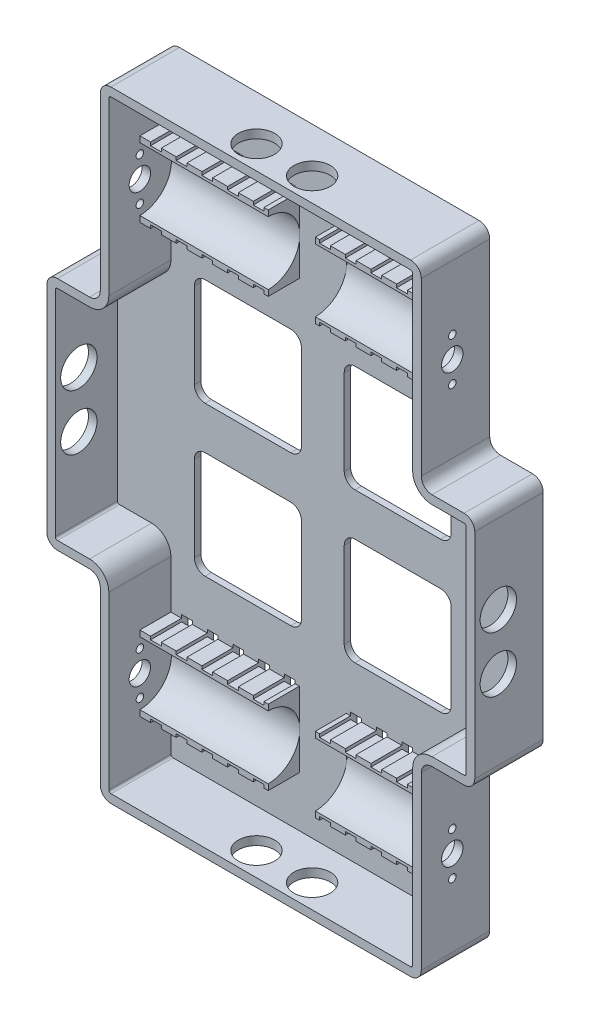
from build123d import *

# Parameters (mm, degrees)
BOSS_EXTRUDE1_DEPTH                          = 3
FILLET1_R                                    = 5
BOSS_EXTRUDE2_START                          = 29
BOSS_EXTRUDE2_DEPTH                          = 29
SKETCH3_R                                    = 5
SKETCH3_R_2                                  = 1.75
CUT_EXTRUDE1_DEPTH                           = 29
SKETCH4_W                                    = 60
SKETCH4_H                                    = 35
BOSS_EXTRUDE3_DEPTH                          = 14.5
SKETCH5_R                                    = 14.75
CUT_EXTRUDE2_DEPTH                           = 60
SKETCH7_W                                    = 5
SKETCH7_H                                    = 3
CUT_EXTRUDE3_DEPTH                           = 178.006355818
CUT_EXTRUDE4_DEPTH                           = 5
LPATTERN1_COUNT                              = 5
LPATTERN1_PITCH                              = 12
MIRROR1_COPY_1_SKETCH_W                      = 5
MIRROR1_COPY_1_SKETCH_H                      = 3
MIRROR1_COPY_1_DEPTH                         = 178.006355818
MIRROR1_COPY_2_SKETCH_W                      = 5
MIRROR1_COPY_2_SKETCH_H                      = 3
MIRROR1_COPY_2_DEPTH                         = 178.006355818
MIRROR1_COPY_3_SKETCH_W                      = 5
MIRROR1_COPY_3_SKETCH_H                      = 3
MIRROR1_COPY_3_DEPTH                         = 178.006355818
MIRROR1_COPY_4_SKETCH_W                      = 5
MIRROR1_COPY_4_SKETCH_H                      = 3
MIRROR1_COPY_4_DEPTH                         = 178.006355818
MIRROR1_COPY_5_DEPTH                         = 5
MIRROR1_COPY_6_DEPTH                         = 5
MIRROR1_COPY_7_DEPTH                         = 5
MIRROR1_COPY_8_DEPTH                         = 5
MIRROR1_AT_THE_SECOND_PLANE_COPY_1_SKETC_W   = 5
MIRROR1_AT_THE_SECOND_PLANE_COPY_1_SKETC_H   = 3
MIRROR1_AT_THE_SECOND_PLANE_COPY_1_DEPTH     = 178.006355818
MIRROR1_AT_THE_SECOND_PLANE_COPY_2_SKETC_W   = 5
MIRROR1_AT_THE_SECOND_PLANE_COPY_2_SKETC_H   = 3
MIRROR1_AT_THE_SECOND_PLANE_COPY_2_DEPTH     = 178.006355818
MIRROR1_AT_THE_SECOND_PLANE_COPY_3_SKETC_W   = 5
MIRROR1_AT_THE_SECOND_PLANE_COPY_3_SKETC_H   = 3
MIRROR1_AT_THE_SECOND_PLANE_COPY_3_DEPTH     = 178.006355818
MIRROR1_AT_THE_SECOND_PLANE_COPY_4_SKETC_W   = 5
MIRROR1_AT_THE_SECOND_PLANE_COPY_4_SKETC_H   = 3
MIRROR1_AT_THE_SECOND_PLANE_COPY_4_DEPTH     = 178.006355818
MIRROR1_AT_THE_SECOND_PLANE_COPY_5_DEPTH     = 5
MIRROR1_AT_THE_SECOND_PLANE_COPY_6_DEPTH     = 5
MIRROR1_AT_THE_SECOND_PLANE_COPY_7_DEPTH     = 5
MIRROR1_AT_THE_SECOND_PLANE_COPY_8_DEPTH     = 5
MIRROR1_AT_THE_SECOND_PLANE_COPY_9_SKETC_R   = 5
MIRROR1_AT_THE_SECOND_PLANE_COPY_9_SKETC_R_2 = 1.75
MIRROR1_AT_THE_SECOND_PLANE_COPY_9_DEPTH     = 29
MIRROR1_AT_THE_SECOND_PLANE_COPY_10_SKET_W   = 60
MIRROR1_AT_THE_SECOND_PLANE_COPY_10_SKET_H   = 35
MIRROR1_AT_THE_SECOND_PLANE_COPY_10_DEPTH    = 14.5
MIRROR1_AT_THE_SECOND_PLANE_COPY_11_SKET_R   = 14.75
MIRROR1_AT_THE_SECOND_PLANE_COPY_11_DEPTH    = 60
MIRROR1_AT_THE_SECOND_PLANE_COPY_12_SKET_W   = 5
MIRROR1_AT_THE_SECOND_PLANE_COPY_12_SKET_H   = 3
MIRROR1_AT_THE_SECOND_PLANE_COPY_12_DEPTH    = 178.006355818
MIRROR1_AT_THE_SECOND_PLANE_COPY_13_DEPTH    = 5
MIRROR1_AT_THE_SECOND_PLANE_COPY_14_SKET_W   = 5
MIRROR1_AT_THE_SECOND_PLANE_COPY_14_SKET_H   = 3
MIRROR1_AT_THE_SECOND_PLANE_COPY_14_DEPTH    = 178.006355818
MIRROR1_AT_THE_SECOND_PLANE_COPY_15_SKET_W   = 5
MIRROR1_AT_THE_SECOND_PLANE_COPY_15_SKET_H   = 3
MIRROR1_AT_THE_SECOND_PLANE_COPY_15_DEPTH    = 178.006355818
MIRROR1_AT_THE_SECOND_PLANE_COPY_16_SKET_W   = 5
MIRROR1_AT_THE_SECOND_PLANE_COPY_16_SKET_H   = 3
MIRROR1_AT_THE_SECOND_PLANE_COPY_16_DEPTH    = 178.006355818
MIRROR1_AT_THE_SECOND_PLANE_COPY_17_SKET_W   = 5
MIRROR1_AT_THE_SECOND_PLANE_COPY_17_SKET_H   = 3
MIRROR1_AT_THE_SECOND_PLANE_COPY_17_DEPTH    = 178.006355818
MIRROR1_AT_THE_SECOND_PLANE_COPY_18_DEPTH    = 5
MIRROR1_AT_THE_SECOND_PLANE_COPY_19_DEPTH    = 5
MIRROR1_AT_THE_SECOND_PLANE_COPY_20_DEPTH    = 5
MIRROR1_AT_THE_SECOND_PLANE_COPY_21_DEPTH    = 5
CUT_EXTRUDE6_REACH                           = 310.422
SKETCH11_R                                   = 8.5
SKETCH12_R                                   = 8.5
CUT_EXTRUDE7_DEPTH                           = 250.096366894
CUT_EXTRUDE8_DEPTH                           = 180.022344974
MIRROR3_AT_THE_SECOND_PLANE_COPY_1_DEPTH     = 180.022344974


with BuildPart() as part:
    # Sketch1 → Boss-Extrude1 (new body)
    with BuildSketch(Plane.XY):
        Polygon((-75, -145), (75, -145), (75, -55), (100, -55), (100, 55), (75, 55), (75, 145), (-75, 145), (-75, 55), (-100, 55), (-100, -55), (-75, -55), align=None)
    extrude(amount=BOSS_EXTRUDE1_DEPTH)

    # Fillet1
    fillet1_edges = [part.edges().sort_by_distance(p)[0] for p in [
        (-75, -55, 1.5),
        (-100, -55, 1.5),
        (-100, 55, 1.5),
        (-75, 55, 1.5),
        (-75, 145, 1.5),
        (75, 145, 1.5),
        (75, 55, 1.5),
        (100, 55, 1.5),
        (100, -55, 1.5),
        (75, -55, 1.5),
        (75, -145, 1.5),
        (-75, -145, 1.5),
    ]]
    fillet(fillet1_edges, radius=FILLET1_R)

    # Sketch2 → Boss-Extrude2 (add)
    with BuildSketch(Plane.XY.offset(3).offset(BOSS_EXTRUDE2_START)):
        with BuildLine():
            Line((-100, 50), (-100, -50))
            ThreePointArc((-100, -50), (-98.535533906, -53.535533906), (-95, -55))
            Line((-95, -55), (-80, -55))
            ThreePointArc((-80, -55), (-76.464466094, -56.464466094), (-75, -60))
            Line((-75, -60), (-75, -140))
            ThreePointArc((-75, -140), (-73.535533906, -143.535533906), (-70, -145))
            Line((-70, -145), (70, -145))
            ThreePointArc((70, -145), (73.535533906, -143.535533906), (75, -140))
            Line((75, -140), (75, -60))
            ThreePointArc((75, -60), (76.464466094, -56.464466094), (80, -55))
            Line((80, -55), (95, -55))
            ThreePointArc((95, -55), (98.535533906, -53.535533906), (100, -50))
            Line((100, -50), (100, 50))
            ThreePointArc((100, 50), (98.535533906, 53.535533906), (95, 55))
            Line((95, 55), (80, 55))
            ThreePointArc((80, 55), (76.464466094, 56.464466094), (75, 60))
            Line((75, 60), (75, 140))
            ThreePointArc((75, 140), (73.535533906, 143.535533906), (70, 145))
            Line((70, 145), (-70, 145))
            ThreePointArc((-70, 145), (-73.535533906, 143.535533906), (-75, 140))
            Line((-75, 140), (-75, 60))
            ThreePointArc((-75, 60), (-76.464466094, 56.464466094), (-80, 55))
            Line((-80, 55), (-95, 55))
            ThreePointArc((-95, 55), (-98.535533906, 53.535533906), (-100, 50))
        make_face()
        with BuildLine():
            Line((-96, 50), (-96, -50))
            ThreePointArc((-96, -50), (-95.707106781, -50.707106781), (-95, -51))
            Line((-95, -51), (-80, -51))
            ThreePointArc((-80, -51), (-73.636038969, -53.636038969), (-71, -60))
            Line((-71, -60), (-71, -140))
            ThreePointArc((-71, -140), (-70.707106781, -140.707106781), (-70, -141))
            Line((-70, -141), (70, -141))
            ThreePointArc((70, -141), (70.707106781, -140.707106781), (71, -140))
            Line((71, -140), (71, -60))
            ThreePointArc((71, -60), (73.636038969, -53.636038969), (80, -51))
            Line((80, -51), (95, -51))
            ThreePointArc((95, -51), (95.707106781, -50.707106781), (96, -50))
            Line((96, -50), (96, 50))
            ThreePointArc((96, 50), (95.707106781, 50.707106781), (95, 51))
            Line((95, 51), (80, 51))
            ThreePointArc((80, 51), (73.636038969, 53.636038969), (71, 60))
            Line((71, 60), (71, 140))
            ThreePointArc((71, 140), (70.707106781, 140.707106781), (70, 141))
            Line((70, 141), (-70, 141))
            ThreePointArc((-70, 141), (-70.707106781, 140.707106781), (-71, 140))
            Line((-71, 140), (-71, 60))
            ThreePointArc((-71, 60), (-73.636038969, 53.636038969), (-80, 51))
            Line((-80, 51), (-95, 51))
            ThreePointArc((-95, 51), (-95.707106781, 50.707106781), (-96, 50))
        make_face(mode=Mode.SUBTRACT)
    extrude(amount=-BOSS_EXTRUDE2_DEPTH)

    # Sketch3 → Cut-Extrude1 (cut)
    with BuildSketch(Plane.ZY.offset(75)):
        with Locations(Location((17.5, -100, 0), (0, 0, 270))):
            Circle(SKETCH3_R)
        with Locations(Location((17.5, -90, 0), (0, 0, 270))):
            Circle(SKETCH3_R_2)
        with Locations(Location((17.5, -110, 0), (0, 0, 270))):
            Circle(SKETCH3_R_2)
    cut_extrude1 = extrude(amount=-CUT_EXTRUDE1_DEPTH, mode=Mode.SUBTRACT)

    # Sketch4 → Boss-Extrude3 (add)
    with BuildSketch(Plane.XY.offset(3)):
        with Locations((-41, -100)):
            Rectangle(SKETCH4_W, SKETCH4_H)
    boss_extrude3 = extrude(amount=BOSS_EXTRUDE3_DEPTH)

    # Sketch5 → Cut-Extrude2 (cut)
    with BuildSketch(Plane(origin=(-11, 0, 0), x_dir=(0, 0, -1), z_dir=(1, 0, 0))):
        with Locations((-17.5, -100)):
            Circle(SKETCH5_R)
    cut_extrude2 = extrude(amount=-CUT_EXTRUDE2_DEPTH, mode=Mode.SUBTRACT)

    # Sketch7 → Cut-Extrude3 (cut, through all)
    with BuildSketch(Plane.XY.offset(17.5)):
        with Locations((-63.5, -117.5)):
            Rectangle(SKETCH7_W, SKETCH7_H)
        with Locations((-63.5, -82.5)):
            Rectangle(SKETCH7_W, SKETCH7_H)
    cut_extrude3 = extrude(amount=-CUT_EXTRUDE3_DEPTH, mode=Mode.SUBTRACT)

    # Sketch8 → Cut-Extrude4 (cut)
    with BuildSketch(Plane(origin=(-66, 0, 0), x_dir=(0, 0, -1), z_dir=(1, 0, 0))):
        Polygon((0, -84), (0, -116), (-3, -116), (-1.5, -114.5), (-1.5, -85.5), (-3, -84), align=None)
    cut_extrude4 = extrude(amount=CUT_EXTRUDE4_DEPTH, mode=Mode.SUBTRACT)

    # LPattern1: Cut-Extrude3, Cut-Extrude4 ×5
    with Locations(*[(i * LPATTERN1_PITCH, 0, 0) for i in range(1, LPATTERN1_COUNT)]):
        add(cut_extrude3, mode=Mode.SUBTRACT)
        add(cut_extrude4, mode=Mode.SUBTRACT)

    # Mirror1: Cut-Extrude1, Boss-Extrude3, Cut-Extrude2, Cut-Extrude3, Cut-Extrude4 across plane
    add(cut_extrude1.mirror(Plane(origin=(0, 0, 0), x_dir=(0, 0, 1), z_dir=(1, 0, 0))), mode=Mode.SUBTRACT)
    add(boss_extrude3.mirror(Plane(origin=(0, 0, 0), x_dir=(0, 0, 1), z_dir=(1, 0, 0))))
    add(cut_extrude2.mirror(Plane(origin=(0, 0, 0), x_dir=(0, 0, 1), z_dir=(1, 0, 0))), mode=Mode.SUBTRACT)
    add(cut_extrude3.mirror(Plane(origin=(0, 0, 0), x_dir=(0, 0, 1), z_dir=(1, 0, 0))), mode=Mode.SUBTRACT)
    add(cut_extrude4.mirror(Plane(origin=(0, 0, 0), x_dir=(0, 0, 1), z_dir=(1, 0, 0))), mode=Mode.SUBTRACT)

    # Mirror1 copy 1 sketch → Mirror1 copy 1 (cut, through all)
    with BuildSketch(Plane(origin=(-12, 0, 17.5), x_dir=(-1, 0, 0), z_dir=(0, 0, 1))):
        with Locations((-63.5, 117.5)):
            Rectangle(MIRROR1_COPY_1_SKETCH_W, MIRROR1_COPY_1_SKETCH_H)
        with Locations((-63.5, 82.5)):
            Rectangle(MIRROR1_COPY_1_SKETCH_W, MIRROR1_COPY_1_SKETCH_H)
    extrude(amount=-MIRROR1_COPY_1_DEPTH, mode=Mode.SUBTRACT)

    # Mirror1 copy 2 sketch → Mirror1 copy 2 (cut, through all)
    with BuildSketch(Plane(origin=(-24, 0, 17.5), x_dir=(-1, 0, 0), z_dir=(0, 0, 1))):
        with Locations((-63.5, 117.5)):
            Rectangle(MIRROR1_COPY_2_SKETCH_W, MIRROR1_COPY_2_SKETCH_H)
        with Locations((-63.5, 82.5)):
            Rectangle(MIRROR1_COPY_2_SKETCH_W, MIRROR1_COPY_2_SKETCH_H)
    extrude(amount=-MIRROR1_COPY_2_DEPTH, mode=Mode.SUBTRACT)

    # Mirror1 copy 3 sketch → Mirror1 copy 3 (cut, through all)
    with BuildSketch(Plane(origin=(-36, 0, 17.5), x_dir=(-1, 0, 0), z_dir=(0, 0, 1))):
        with Locations((-63.5, 117.5)):
            Rectangle(MIRROR1_COPY_3_SKETCH_W, MIRROR1_COPY_3_SKETCH_H)
        with Locations((-63.5, 82.5)):
            Rectangle(MIRROR1_COPY_3_SKETCH_W, MIRROR1_COPY_3_SKETCH_H)
    extrude(amount=-MIRROR1_COPY_3_DEPTH, mode=Mode.SUBTRACT)

    # Mirror1 copy 4 sketch → Mirror1 copy 4 (cut, through all)
    with BuildSketch(Plane(origin=(-48, 0, 17.5), x_dir=(-1, 0, 0), z_dir=(0, 0, 1))):
        with Locations((-63.5, 117.5)):
            Rectangle(MIRROR1_COPY_4_SKETCH_W, MIRROR1_COPY_4_SKETCH_H)
        with Locations((-63.5, 82.5)):
            Rectangle(MIRROR1_COPY_4_SKETCH_W, MIRROR1_COPY_4_SKETCH_H)
    extrude(amount=-MIRROR1_COPY_4_DEPTH, mode=Mode.SUBTRACT)

    # Mirror1 copy 5 sketch → Mirror1 copy 5 (cut)
    with BuildSketch(Plane(origin=(54, 0, 0), x_dir=(0, 0, -1), z_dir=(-1, 0, 0))):
        Polygon((0, 84), (0, 116), (-3, 116), (-1.5, 114.5), (-1.5, 85.5), (-3, 84), align=None)
    extrude(amount=MIRROR1_COPY_5_DEPTH, mode=Mode.SUBTRACT)

    # Mirror1 copy 6 sketch → Mirror1 copy 6 (cut)
    with BuildSketch(Plane(origin=(42, 0, 0), x_dir=(0, 0, -1), z_dir=(-1, 0, 0))):
        Polygon((0, 84), (0, 116), (-3, 116), (-1.5, 114.5), (-1.5, 85.5), (-3, 84), align=None)
    extrude(amount=MIRROR1_COPY_6_DEPTH, mode=Mode.SUBTRACT)

    # Mirror1 copy 7 sketch → Mirror1 copy 7 (cut)
    with BuildSketch(Plane(origin=(30, 0, 0), x_dir=(0, 0, -1), z_dir=(-1, 0, 0))):
        Polygon((0, 84), (0, 116), (-3, 116), (-1.5, 114.5), (-1.5, 85.5), (-3, 84), align=None)
    extrude(amount=MIRROR1_COPY_7_DEPTH, mode=Mode.SUBTRACT)

    # Mirror1 copy 8 sketch → Mirror1 copy 8 (cut)
    with BuildSketch(Plane(origin=(18, 0, 0), x_dir=(0, 0, -1), z_dir=(-1, 0, 0))):
        Polygon((0, 84), (0, 116), (-3, 116), (-1.5, 114.5), (-1.5, 85.5), (-3, 84), align=None)
    extrude(amount=MIRROR1_COPY_8_DEPTH, mode=Mode.SUBTRACT)

    # Mirror1 at the second plane: Cut-Extrude1, Boss-Extrude3, Cut-Extrude2, Cut-Extrude3, Cut-Extrude4 across plane
    add(cut_extrude1.mirror(Plane.ZX), mode=Mode.SUBTRACT)
    add(boss_extrude3.mirror(Plane.ZX))
    add(cut_extrude2.mirror(Plane.ZX), mode=Mode.SUBTRACT)
    add(cut_extrude3.mirror(Plane.ZX), mode=Mode.SUBTRACT)
    add(cut_extrude4.mirror(Plane.ZX), mode=Mode.SUBTRACT)

    # Mirror1 at the second plane copy 1 sketc → Mirror1 at the second plane copy 1 (cut, through all)
    with BuildSketch(Plane(origin=(12, 0, 17.5), x_dir=(1, 0, 0), z_dir=(0, 0, 1))):
        with Locations((-63.5, 117.5)):
            Rectangle(MIRROR1_AT_THE_SECOND_PLANE_COPY_1_SKETC_W, MIRROR1_AT_THE_SECOND_PLANE_COPY_1_SKETC_H)
        with Locations((-63.5, 82.5)):
            Rectangle(MIRROR1_AT_THE_SECOND_PLANE_COPY_1_SKETC_W, MIRROR1_AT_THE_SECOND_PLANE_COPY_1_SKETC_H)
    extrude(amount=-MIRROR1_AT_THE_SECOND_PLANE_COPY_1_DEPTH, mode=Mode.SUBTRACT)

    # Mirror1 at the second plane copy 2 sketc → Mirror1 at the second plane copy 2 (cut, through all)
    with BuildSketch(Plane(origin=(24, 0, 17.5), x_dir=(1, 0, 0), z_dir=(0, 0, 1))):
        with Locations((-63.5, 117.5)):
            Rectangle(MIRROR1_AT_THE_SECOND_PLANE_COPY_2_SKETC_W, MIRROR1_AT_THE_SECOND_PLANE_COPY_2_SKETC_H)
        with Locations((-63.5, 82.5)):
            Rectangle(MIRROR1_AT_THE_SECOND_PLANE_COPY_2_SKETC_W, MIRROR1_AT_THE_SECOND_PLANE_COPY_2_SKETC_H)
    extrude(amount=-MIRROR1_AT_THE_SECOND_PLANE_COPY_2_DEPTH, mode=Mode.SUBTRACT)

    # Mirror1 at the second plane copy 3 sketc → Mirror1 at the second plane copy 3 (cut, through all)
    with BuildSketch(Plane(origin=(36, 0, 17.5), x_dir=(1, 0, 0), z_dir=(0, 0, 1))):
        with Locations((-63.5, 117.5)):
            Rectangle(MIRROR1_AT_THE_SECOND_PLANE_COPY_3_SKETC_W, MIRROR1_AT_THE_SECOND_PLANE_COPY_3_SKETC_H)
        with Locations((-63.5, 82.5)):
            Rectangle(MIRROR1_AT_THE_SECOND_PLANE_COPY_3_SKETC_W, MIRROR1_AT_THE_SECOND_PLANE_COPY_3_SKETC_H)
    extrude(amount=-MIRROR1_AT_THE_SECOND_PLANE_COPY_3_DEPTH, mode=Mode.SUBTRACT)

    # Mirror1 at the second plane copy 4 sketc → Mirror1 at the second plane copy 4 (cut, through all)
    with BuildSketch(Plane(origin=(48, 0, 17.5), x_dir=(1, 0, 0), z_dir=(0, 0, 1))):
        with Locations((-63.5, 117.5)):
            Rectangle(MIRROR1_AT_THE_SECOND_PLANE_COPY_4_SKETC_W, MIRROR1_AT_THE_SECOND_PLANE_COPY_4_SKETC_H)
        with Locations((-63.5, 82.5)):
            Rectangle(MIRROR1_AT_THE_SECOND_PLANE_COPY_4_SKETC_W, MIRROR1_AT_THE_SECOND_PLANE_COPY_4_SKETC_H)
    extrude(amount=-MIRROR1_AT_THE_SECOND_PLANE_COPY_4_DEPTH, mode=Mode.SUBTRACT)

    # Mirror1 at the second plane copy 5 sketc → Mirror1 at the second plane copy 5 (cut)
    with BuildSketch(Plane(origin=(-54, 0, 0), x_dir=(0, 0, -1), z_dir=(1, 0, 0))):
        Polygon((0, 84), (0, 116), (-3, 116), (-1.5, 114.5), (-1.5, 85.5), (-3, 84), align=None)
    extrude(amount=MIRROR1_AT_THE_SECOND_PLANE_COPY_5_DEPTH, mode=Mode.SUBTRACT)

    # Mirror1 at the second plane copy 6 sketc → Mirror1 at the second plane copy 6 (cut)
    with BuildSketch(Plane(origin=(-42, 0, 0), x_dir=(0, 0, -1), z_dir=(1, 0, 0))):
        Polygon((0, 84), (0, 116), (-3, 116), (-1.5, 114.5), (-1.5, 85.5), (-3, 84), align=None)
    extrude(amount=MIRROR1_AT_THE_SECOND_PLANE_COPY_6_DEPTH, mode=Mode.SUBTRACT)

    # Mirror1 at the second plane copy 7 sketc → Mirror1 at the second plane copy 7 (cut)
    with BuildSketch(Plane(origin=(-30, 0, 0), x_dir=(0, 0, -1), z_dir=(1, 0, 0))):
        Polygon((0, 84), (0, 116), (-3, 116), (-1.5, 114.5), (-1.5, 85.5), (-3, 84), align=None)
    extrude(amount=MIRROR1_AT_THE_SECOND_PLANE_COPY_7_DEPTH, mode=Mode.SUBTRACT)

    # Mirror1 at the second plane copy 8 sketc → Mirror1 at the second plane copy 8 (cut)
    with BuildSketch(Plane(origin=(-18, 0, 0), x_dir=(0, 0, -1), z_dir=(1, 0, 0))):
        Polygon((0, 84), (0, 116), (-3, 116), (-1.5, 114.5), (-1.5, 85.5), (-3, 84), align=None)
    extrude(amount=MIRROR1_AT_THE_SECOND_PLANE_COPY_8_DEPTH, mode=Mode.SUBTRACT)

    # Mirror1 at the second plane copy 9 sketc → Mirror1 at the second plane copy 9 (cut)
    with BuildSketch(Plane(origin=(75, 0, 0), x_dir=(0, 0, 1), z_dir=(1, 0, 0))):
        with Locations(Location((17.5, -100, 0), (0, 0, 270))):
            Circle(MIRROR1_AT_THE_SECOND_PLANE_COPY_9_SKETC_R)
        with Locations(Location((17.5, -90, 0), (0, 0, 270))):
            Circle(MIRROR1_AT_THE_SECOND_PLANE_COPY_9_SKETC_R_2)
        with Locations(Location((17.5, -110, 0), (0, 0, 270))):
            Circle(MIRROR1_AT_THE_SECOND_PLANE_COPY_9_SKETC_R_2)
    extrude(amount=-MIRROR1_AT_THE_SECOND_PLANE_COPY_9_DEPTH, mode=Mode.SUBTRACT)

    # Mirror1 at the second plane copy 10 sket → Mirror1 at the second plane copy 10 (add)
    with BuildSketch(Plane(origin=(0, 0, 3), x_dir=(-1, 0, 0), z_dir=(0, 0, 1))):
        with Locations((-41, -100)):
            Rectangle(MIRROR1_AT_THE_SECOND_PLANE_COPY_10_SKET_W, MIRROR1_AT_THE_SECOND_PLANE_COPY_10_SKET_H)
    extrude(amount=MIRROR1_AT_THE_SECOND_PLANE_COPY_10_DEPTH)

    # Mirror1 at the second plane copy 11 sket → Mirror1 at the second plane copy 11 (cut)
    with BuildSketch(Plane(origin=(11, 0, 0), x_dir=(0, 0, -1), z_dir=(-1, 0, 0))):
        with Locations((-17.5, -100)):
            Circle(MIRROR1_AT_THE_SECOND_PLANE_COPY_11_SKET_R)
    extrude(amount=-MIRROR1_AT_THE_SECOND_PLANE_COPY_11_DEPTH, mode=Mode.SUBTRACT)

    # Mirror1 at the second plane copy 12 sket → Mirror1 at the second plane copy 12 (cut, through all)
    with BuildSketch(Plane(origin=(0, 0, 17.5), x_dir=(-1, 0, 0), z_dir=(0, 0, 1))):
        with Locations((-63.5, -117.5)):
            Rectangle(MIRROR1_AT_THE_SECOND_PLANE_COPY_12_SKET_W, MIRROR1_AT_THE_SECOND_PLANE_COPY_12_SKET_H)
        with Locations((-63.5, -82.5)):
            Rectangle(MIRROR1_AT_THE_SECOND_PLANE_COPY_12_SKET_W, MIRROR1_AT_THE_SECOND_PLANE_COPY_12_SKET_H)
    extrude(amount=-MIRROR1_AT_THE_SECOND_PLANE_COPY_12_DEPTH, mode=Mode.SUBTRACT)

    # Mirror1 at the second plane copy 13 sket → Mirror1 at the second plane copy 13 (cut)
    with BuildSketch(Plane(origin=(66, 0, 0), x_dir=(0, 0, -1), z_dir=(-1, 0, 0))):
        Polygon((0, -84), (0, -116), (-3, -116), (-1.5, -114.5), (-1.5, -85.5), (-3, -84), align=None)
    extrude(amount=MIRROR1_AT_THE_SECOND_PLANE_COPY_13_DEPTH, mode=Mode.SUBTRACT)

    # Mirror1 at the second plane copy 14 sket → Mirror1 at the second plane copy 14 (cut, through all)
    with BuildSketch(Plane(origin=(-12, 0, 17.5), x_dir=(-1, 0, 0), z_dir=(0, 0, 1))):
        with Locations((-63.5, -117.5)):
            Rectangle(MIRROR1_AT_THE_SECOND_PLANE_COPY_14_SKET_W, MIRROR1_AT_THE_SECOND_PLANE_COPY_14_SKET_H)
        with Locations((-63.5, -82.5)):
            Rectangle(MIRROR1_AT_THE_SECOND_PLANE_COPY_14_SKET_W, MIRROR1_AT_THE_SECOND_PLANE_COPY_14_SKET_H)
    extrude(amount=-MIRROR1_AT_THE_SECOND_PLANE_COPY_14_DEPTH, mode=Mode.SUBTRACT)

    # Mirror1 at the second plane copy 15 sket → Mirror1 at the second plane copy 15 (cut, through all)
    with BuildSketch(Plane(origin=(-24, 0, 17.5), x_dir=(-1, 0, 0), z_dir=(0, 0, 1))):
        with Locations((-63.5, -117.5)):
            Rectangle(MIRROR1_AT_THE_SECOND_PLANE_COPY_15_SKET_W, MIRROR1_AT_THE_SECOND_PLANE_COPY_15_SKET_H)
        with Locations((-63.5, -82.5)):
            Rectangle(MIRROR1_AT_THE_SECOND_PLANE_COPY_15_SKET_W, MIRROR1_AT_THE_SECOND_PLANE_COPY_15_SKET_H)
    extrude(amount=-MIRROR1_AT_THE_SECOND_PLANE_COPY_15_DEPTH, mode=Mode.SUBTRACT)

    # Mirror1 at the second plane copy 16 sket → Mirror1 at the second plane copy 16 (cut, through all)
    with BuildSketch(Plane(origin=(-36, 0, 17.5), x_dir=(-1, 0, 0), z_dir=(0, 0, 1))):
        with Locations((-63.5, -117.5)):
            Rectangle(MIRROR1_AT_THE_SECOND_PLANE_COPY_16_SKET_W, MIRROR1_AT_THE_SECOND_PLANE_COPY_16_SKET_H)
        with Locations((-63.5, -82.5)):
            Rectangle(MIRROR1_AT_THE_SECOND_PLANE_COPY_16_SKET_W, MIRROR1_AT_THE_SECOND_PLANE_COPY_16_SKET_H)
    extrude(amount=-MIRROR1_AT_THE_SECOND_PLANE_COPY_16_DEPTH, mode=Mode.SUBTRACT)

    # Mirror1 at the second plane copy 17 sket → Mirror1 at the second plane copy 17 (cut, through all)
    with BuildSketch(Plane(origin=(-48, 0, 17.5), x_dir=(-1, 0, 0), z_dir=(0, 0, 1))):
        with Locations((-63.5, -117.5)):
            Rectangle(MIRROR1_AT_THE_SECOND_PLANE_COPY_17_SKET_W, MIRROR1_AT_THE_SECOND_PLANE_COPY_17_SKET_H)
        with Locations((-63.5, -82.5)):
            Rectangle(MIRROR1_AT_THE_SECOND_PLANE_COPY_17_SKET_W, MIRROR1_AT_THE_SECOND_PLANE_COPY_17_SKET_H)
    extrude(amount=-MIRROR1_AT_THE_SECOND_PLANE_COPY_17_DEPTH, mode=Mode.SUBTRACT)

    # Mirror1 at the second plane copy 18 sket → Mirror1 at the second plane copy 18 (cut)
    with BuildSketch(Plane(origin=(54, 0, 0), x_dir=(0, 0, -1), z_dir=(-1, 0, 0))):
        Polygon((0, -84), (0, -116), (-3, -116), (-1.5, -114.5), (-1.5, -85.5), (-3, -84), align=None)
    extrude(amount=MIRROR1_AT_THE_SECOND_PLANE_COPY_18_DEPTH, mode=Mode.SUBTRACT)

    # Mirror1 at the second plane copy 19 sket → Mirror1 at the second plane copy 19 (cut)
    with BuildSketch(Plane(origin=(42, 0, 0), x_dir=(0, 0, -1), z_dir=(-1, 0, 0))):
        Polygon((0, -84), (0, -116), (-3, -116), (-1.5, -114.5), (-1.5, -85.5), (-3, -84), align=None)
    extrude(amount=MIRROR1_AT_THE_SECOND_PLANE_COPY_19_DEPTH, mode=Mode.SUBTRACT)

    # Mirror1 at the second plane copy 20 sket → Mirror1 at the second plane copy 20 (cut)
    with BuildSketch(Plane(origin=(30, 0, 0), x_dir=(0, 0, -1), z_dir=(-1, 0, 0))):
        Polygon((0, -84), (0, -116), (-3, -116), (-1.5, -114.5), (-1.5, -85.5), (-3, -84), align=None)
    extrude(amount=MIRROR1_AT_THE_SECOND_PLANE_COPY_20_DEPTH, mode=Mode.SUBTRACT)

    # Mirror1 at the second plane copy 21 sket → Mirror1 at the second plane copy 21 (cut)
    with BuildSketch(Plane(origin=(18, 0, 0), x_dir=(0, 0, -1), z_dir=(-1, 0, 0))):
        Polygon((0, -84), (0, -116), (-3, -116), (-1.5, -114.5), (-1.5, -85.5), (-3, -84), align=None)
    extrude(amount=MIRROR1_AT_THE_SECOND_PLANE_COPY_21_DEPTH, mode=Mode.SUBTRACT)

    # Sketch11 → Cut-Extrude6 (cut, up to next)
    with BuildSketch(Plane(origin=(0, 145, 0), x_dir=(1, 0, 0), z_dir=(0, 1, 0)), mode=Mode.PRIVATE) as cut_extrude6_sk1:
        with Locations(Location((-13, -21, 0), (0, 0, 180))):
            Circle(SKETCH11_R)
    cut_extrude6_tool1 = extrude(cut_extrude6_sk1.sketch, amount=-CUT_EXTRUDE6_REACH, mode=Mode.PRIVATE) & part.part
    # Sketch11 → Cut-Extrude6 (cut, up to next)
    with BuildSketch(Plane(origin=(0, 145, 0), x_dir=(1, 0, 0), z_dir=(0, 1, 0)), mode=Mode.PRIVATE) as cut_extrude6_sk2:
        with Locations(Location((13, -21, 0), (0, 0, 180))):
            Circle(SKETCH11_R)
    cut_extrude6_tool2 = extrude(cut_extrude6_sk2.sketch, amount=-CUT_EXTRUDE6_REACH, mode=Mode.PRIVATE) & part.part
    cut_extrude6_1 = cut_extrude6_tool1.solids().sort_by_distance((-13, 145, 21))[0]
    add(cut_extrude6_1, mode=Mode.SUBTRACT)
    cut_extrude6_2 = cut_extrude6_tool2.solids().sort_by_distance((13, 145, 21))[0]
    add(cut_extrude6_2, mode=Mode.SUBTRACT)
    cut_extrude6 = cut_extrude6_1 + cut_extrude6_2  # Cut-Extrude6 as one shape, for the pattern or mirror that repeats it

    # Mirror2: Cut-Extrude6 across plane
    add(cut_extrude6.mirror(Plane.ZX), mode=Mode.SUBTRACT)

    # Sketch12 → Cut-Extrude7 (cut, through all)
    with BuildSketch(Plane(origin=(100, 0, 0), x_dir=(0, 0, -1), z_dir=(1, 0, 0))):
        with Locations((-21, 13)):
            Circle(SKETCH12_R)
        with Locations((-21, -13)):
            Circle(SKETCH12_R)
    extrude(amount=-CUT_EXTRUDE7_DEPTH, mode=Mode.SUBTRACT)

    # Sketch13 → Cut-Extrude8 (cut, through all)
    with BuildSketch(Plane(origin=(0, 0, 0), x_dir=(-1, 0, 0), z_dir=(0, 0, -1))):
        with BuildLine():
            Line((-55, 60), (-15, 60))
            ThreePointArc((-15, 60), (-11.464466094, 58.535533906), (-10, 55))
            Line((-10, 55), (-10, 15))
            ThreePointArc((-10, 15), (-11.464466094, 11.464466094), (-15, 10))
            Line((-15, 10), (-55, 10))
            ThreePointArc((-55, 10), (-58.535533906, 11.464466094), (-60, 15))
            Line((-60, 15), (-60, 55))
            ThreePointArc((-60, 55), (-58.535533906, 58.535533906), (-55, 60))
        make_face()
    cut_extrude8 = extrude(amount=-CUT_EXTRUDE8_DEPTH, mode=Mode.SUBTRACT)

    # Mirror3: Cut-Extrude8 across plane
    add(cut_extrude8.mirror(Plane(origin=(0, 0, 0), x_dir=(0, 0, 1), z_dir=(1, 0, 0))), mode=Mode.SUBTRACT)

    # Mirror3 at the second plane: Cut-Extrude8 across plane
    add(cut_extrude8.mirror(Plane.ZX), mode=Mode.SUBTRACT)

    # Mirror3 at the second plane copy 1 sketc → Mirror3 at the second plane copy 1 (cut, through all)
    with BuildSketch(Plane(origin=(0, 0, 0), x_dir=(1, 0, 0), z_dir=(0, 0, -1))):
        with BuildLine():
            Line((-55, 60), (-15, 60))
            ThreePointArc((-15, 60), (-11.464466094, 58.535533906), (-10, 55))
            Line((-10, 55), (-10, 15))
            ThreePointArc((-10, 15), (-11.464466094, 11.464466094), (-15, 10))
            Line((-15, 10), (-55, 10))
            ThreePointArc((-55, 10), (-58.535533906, 11.464466094), (-60, 15))
            Line((-60, 15), (-60, 55))
            ThreePointArc((-60, 55), (-58.535533906, 58.535533906), (-55, 60))
        make_face()
    extrude(amount=-MIRROR3_AT_THE_SECOND_PLANE_COPY_1_DEPTH, mode=Mode.SUBTRACT)


solid = part.part
